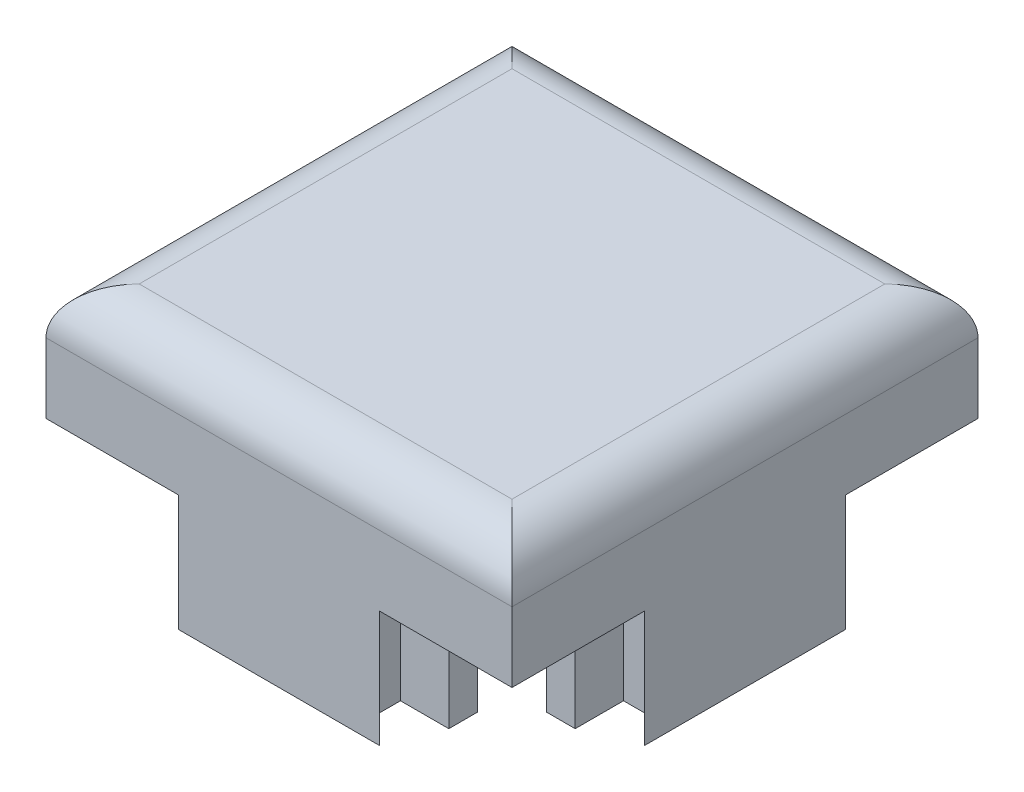
from build123d import *

# Parameters (mm, degrees)
SALIENTE_EXTRUIR1_DEPTH   = 5
SALIENTE_EXTRUIR1_2_DEPTH = 5
SALIENTE_EXTRUIR1_3_DEPTH = 5
SALIENTE_EXTRUIR1_4_DEPTH = 5
CROQUIS3_W                = 20
CROQUIS3_H                = 20
SALIENTE_EXTRUIR2_DEPTH   = 5
REDONDEO1_R               = 2


with BuildPart() as part:
    # Croquis2 → Saliente-Extruir1 (new body)
    with BuildSketch(Plane(origin=(0, 0, 0), x_dir=(1, 0, 0), z_dir=(0, 1, 0))):
        Polygon((-3.880962474, 9.7), (-4.31520152, 10), (4.31520152, 10), (3.880962474, 9.7), (3.100109842, 9.007732001), (3.100109842, 7.886854264), (5.174607071, 7.886854264), (5.174607071, 6.657084853), (2.689193029, 4.171670811), (-2.689193029, 4.171670811), (-5.174607071, 6.657084853), (-5.174607071, 7.886854264), (-3.100109842, 7.886854264), (-3.100109842, 9.007732001), align=None)
    extrude(amount=SALIENTE_EXTRUIR1_DEPTH)



with BuildPart() as body_2:
    # Croquis2 → Saliente-Extruir1 2 (new body)
    with BuildSketch(Plane(origin=(0, 0, 0), x_dir=(1, 0, 0), z_dir=(0, 1, 0))):
        Polygon((10, 4.31520152), (10, -4.31520152), (9.7, -3.880962474), (9.007732001, -3.100109842), (7.886854264, -3.100109842), (7.886854264, -5.174607071), (6.657084853, -5.174607071), (4.171670811, -2.689193029), (4.171670811, 2.689193029), (6.657084853, 5.174607071), (7.886854264, 5.174607071), (7.886854264, 3.100109842), (9.007732001, 3.100109842), (9.7, 3.880962474), align=None)
    extrude(amount=SALIENTE_EXTRUIR1_2_DEPTH)


with BuildPart() as body_3:
    # Croquis2 → Saliente-Extruir1 3 (new body)
    with BuildSketch(Plane(origin=(0, 0, 0), x_dir=(1, 0, 0), z_dir=(0, 1, 0))):
        Polygon((4.31520152, -10), (-4.31520152, -10), (-3.880962474, -9.7), (-3.100109842, -9.007732001), (-3.100109842, -7.886854264), (-5.174607071, -7.886854264), (-5.174607071, -6.657084853), (-2.689193029, -4.171670811), (2.689193029, -4.171670811), (5.174607071, -6.657084853), (5.174607071, -7.886854264), (3.100109842, -7.886854264), (3.100109842, -9.007732001), (3.880962474, -9.7), align=None)
    extrude(amount=SALIENTE_EXTRUIR1_3_DEPTH)


with BuildPart() as body_4:
    # Croquis2 → Saliente-Extruir1 4 (new body)
    with BuildSketch(Plane(origin=(0, 0, 0), x_dir=(1, 0, 0), z_dir=(0, 1, 0))):
        Polygon((-10, -4.31520152), (-10, 4.31520152), (-9.7, 3.880962474), (-9.007732001, 3.100109842), (-7.886854264, 3.100109842), (-7.886854264, 5.174607071), (-6.657084853, 5.174607071), (-4.171670811, 2.689193029), (-4.171670811, -2.689193029), (-6.657084853, -5.174607071), (-7.886854264, -5.174607071), (-7.886854264, -3.100109842), (-9.007732001, -3.100109842), (-9.7, -3.880962474), align=None)
    extrude(amount=SALIENTE_EXTRUIR1_4_DEPTH)


with BuildPart() as part_1:
    add(part.part)

    add(body_2.part)  # Saliente-Extruir2 merges body 2

    add(body_3.part)  # Saliente-Extruir2 merges body 3

    add(body_4.part)  # Saliente-Extruir2 merges body 4
    # Croquis3 → Saliente-Extruir2 (add)
    with BuildSketch(Plane(origin=(0, 5, 0), x_dir=(1, 0, 0), z_dir=(0, 1, 0))):
        Rectangle(CROQUIS3_W, CROQUIS3_H)
    extrude(amount=SALIENTE_EXTRUIR2_DEPTH)

    # Redondeo1
    redondeo1_edges = [part_1.edges().sort_by_distance(p)[0] for p in [
        (10, 10, 0),
        (0, 10, -10),
        (-10, 10, 0),
        (0, 10, 10),
    ]]
    fillet(redondeo1_edges, radius=REDONDEO1_R)


solid = part_1.part
